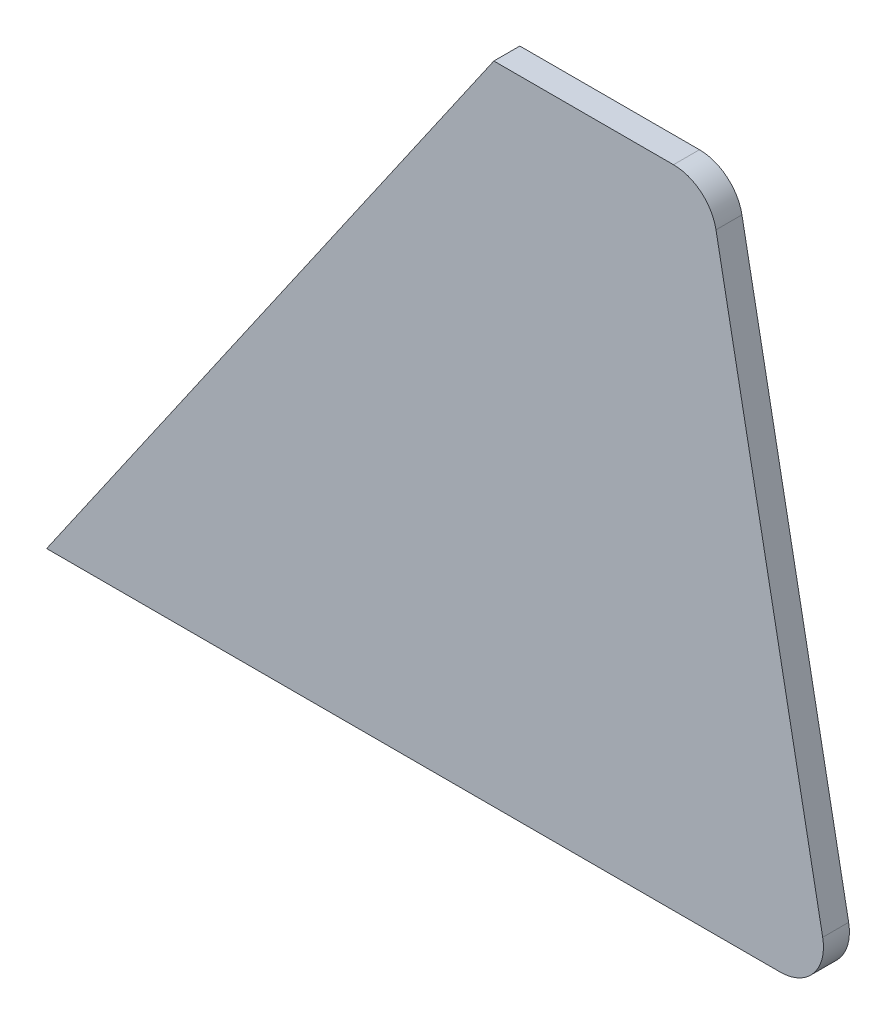
from build123d import *

# Parameters (mm, degrees)
RESSALTO_EXTRUS_O1_DEPTH = 3
FILETE1_R                = 5


with BuildPart() as part:
    # Esboço1 → Ressalto-extrusão1 (new body)
    with BuildSketch(Plane.XY):
        Polygon((0, 0), (24.9, 0), (39.140979909, -74.653831055), (-51.692763366, -74.653831055), align=None)
    extrude(amount=RESSALTO_EXTRUS_O1_DEPTH)

    # Filete1
    filete1_edges = [part.edges().sort_by_distance(p)[0] for p in [
        (24.9, 0, 1.5),
        (39.140979909, -74.653831055, 1.5),
    ]]
    fillet(filete1_edges, radius=FILETE1_R)


solid = part.part
